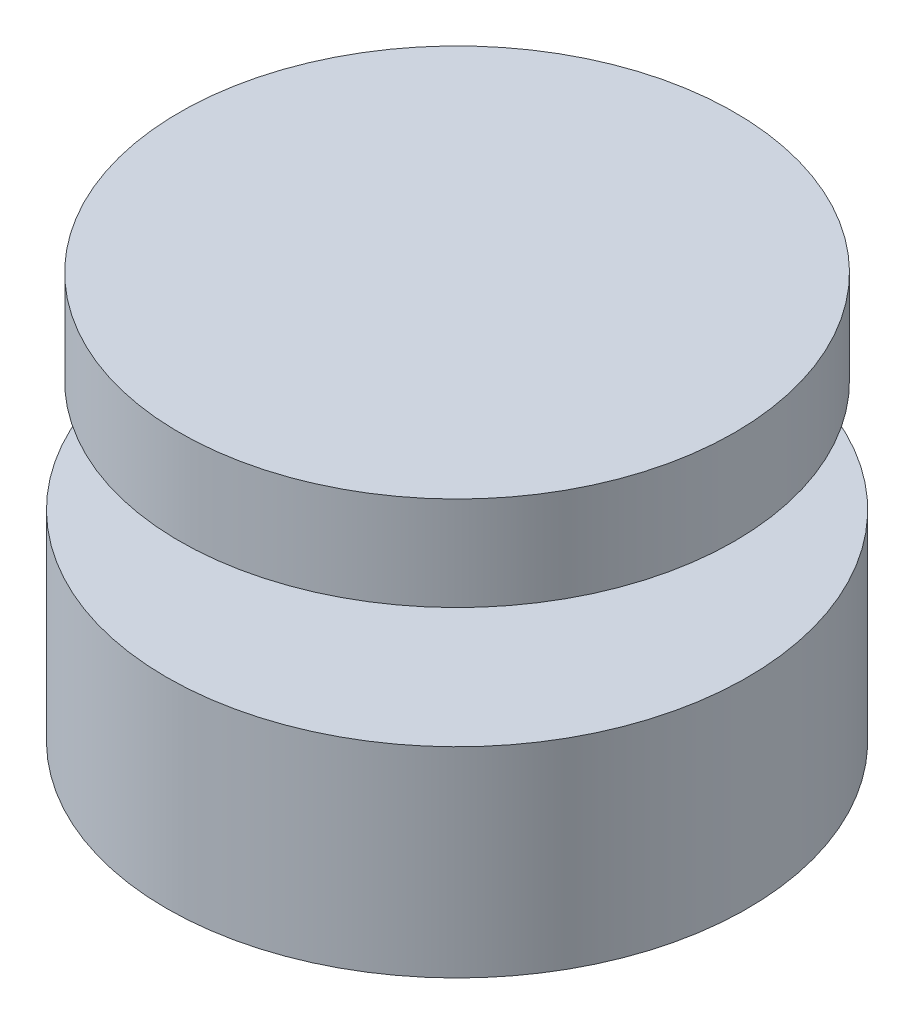
from build123d import *

# Parameters (mm, degrees)
SKETCH1_R           = 2.9
BOSS_EXTRUDE1_DEPTH = 2
SKETCH2_R           = 2
CUT_EXTRUDE1_DEPTH  = 1


with BuildPart() as part:
    # Sketch1 → Boss-Extrude1 (new body)
    with BuildSketch(Plane(origin=(0, 0, 0), x_dir=(1, 0, 0), z_dir=(0, 1, 0))):
        with Locations(Location((0, 0, 0), (0, 0, 270))):
            Circle(SKETCH1_R)
    extrude(amount=BOSS_EXTRUDE1_DEPTH)

    # Sketch2 → Cut-Extrude1 (cut)
    with BuildSketch(Plane.XZ):
        with Locations(Location((0, 0, 0), (0, 0, 270))):
            Circle(SKETCH2_R)
    extrude(amount=-CUT_EXTRUDE1_DEPTH, mode=Mode.SUBTRACT)

    # Sketch3 → Revolve4 (revolve)
    with BuildSketch(Plane.XY, mode=Mode.PRIVATE) as revolve4_sk:
        Polygon((-2.771365676, 3.112953388), (-0.547366303, 3.112953388), (-0.547366303, 2), (0, 2), (0, 4.051740853), (-2.771365676, 4.051740853), align=None)
    revolve(revolve4_sk.sketch.rotate(Axis((0, 2, 0), (0, 1, 0)), 180), axis=Axis((0, 2, 0), (0, 1, 0)))


solid = part.part
